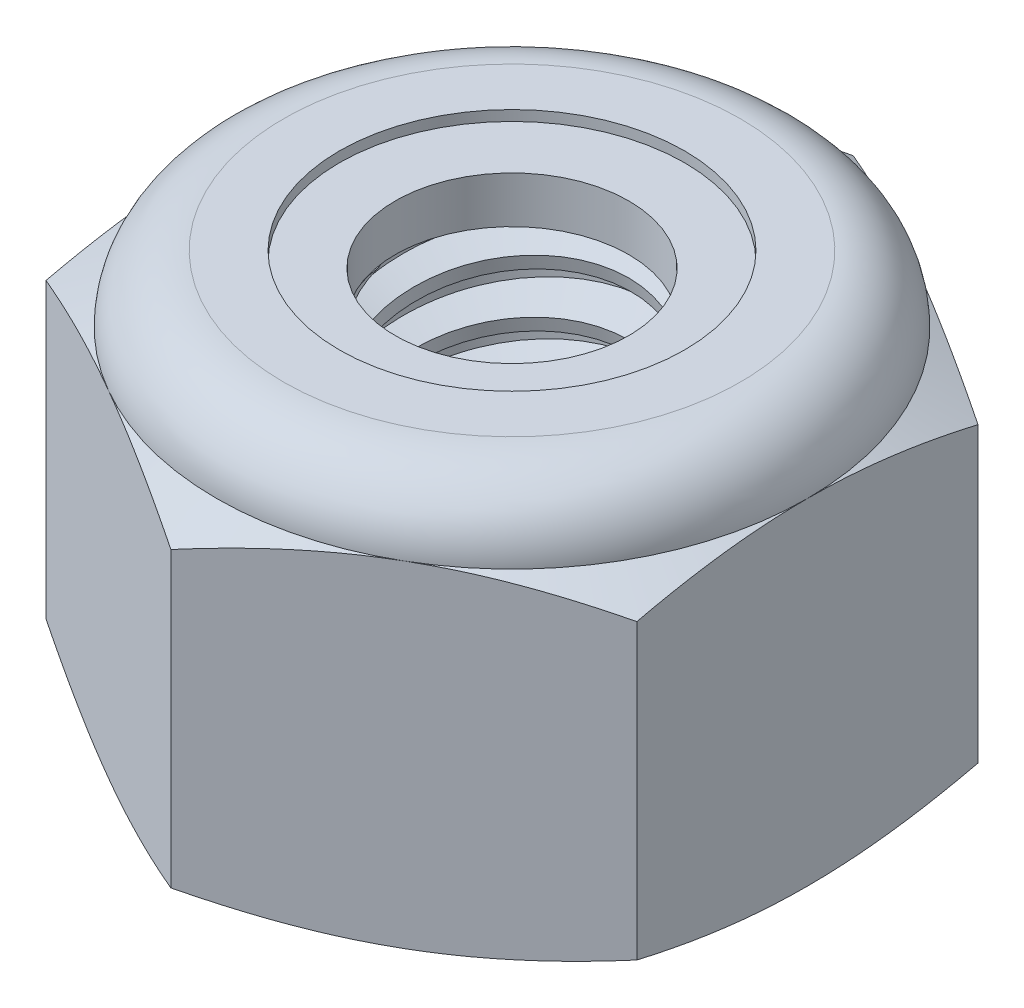
from build123d import *

# Parameters (mm, degrees)
EXTRUDE1_DEPTH      = 5.953125
SKETCH2_W           = 2.0828
SKETCH2_H           = 5.953125
LPATTERN1_COUNT     = 8
LPATTERN1_PITCH     = 0.79375
LPATTERN1_COL_COUNT = 2
LPATTERN1_COL_PITCH = 0.79375


with BuildPart() as part:
    # Sketch1 → Extrude1 (new body)
    with BuildSketch(Plane(origin=(0, 0, 0), x_dir=(1, 0, 0), z_dir=(0, 1, 0))):
        Polygon((0, 5.040989538), (-4.365625, 2.520494769), (-4.365625, -2.520494769), (0, -5.040989538), (4.365625, -2.520494769), (4.365625, 2.520494769), align=None)
    extrude(amount=EXTRUDE1_DEPTH)

    # Sketch4 → Cut-Revolve2 (revolve, cut)
    with BuildSketch(Plane(origin=(0, 0, 0), x_dir=(0, 0, -1), z_dir=(1, 0, 0)), mode=Mode.PRIVATE) as cut_revolve2_sk:
        Polygon((0, 5.953125), (2.0828, 5.953125), (1.725765218, 5.786636947), (1.725765218, 0.166488053), (2.0828, 0), (0, 0), align=None)
    revolve(cut_revolve2_sk.sketch.rotate(Axis((0, 5.953125, 0), (0, 1, 0)), 54.618153421), axis=Axis((0, 5.953125, 0), (0, 1, 0)), mode=Mode.SUBTRACT)


with BuildPart() as body_2:
    # Sketch2 → Revolve1 (revolve)
    with BuildSketch(Plane(origin=(0, 0, 0), x_dir=(0, 0, -1), z_dir=(1, 0, 0))):
        with Locations((1.0414, 2.9765625)):
            Rectangle(SKETCH2_W, SKETCH2_H)
    revolve(axis=Axis((0, -2.0828, 0), (0, 1, 0)))

    # Sketch3 → Cut-Revolve1 (revolve, cut)
    with BuildSketch(Plane(origin=(0, 0, 0), x_dir=(0, 0, -1), z_dir=(1, 0, 0)), mode=Mode.PRIVATE) as cut_revolve1_sk:
        Polygon((2.101371857, 5.855659896), (2.231374854, 5.173404168), (1.762908932, 5.33664843), (1.725765218, 5.531578638), align=None)
    cut_revolve1 = revolve(cut_revolve1_sk.sketch.rotate(Axis((0, 5.953125, 0.162231854), (0, -0.9823254572523518, -0.18718091792156122)), 180), axis=Axis((0, 5.953125, 0.162231854), (0, -0.9823254572523518, -0.18718091792156122)), mode=Mode.SUBTRACT)

    # LPattern1: Cut-Revolve1 ×8
    with Locations(*[(0, -i * LPATTERN1_PITCH, 0) for i in range(1, LPATTERN1_COUNT)]):
        add(cut_revolve1, mode=Mode.SUBTRACT)

    # LPattern1 col: Cut-Revolve1 ×2
    with Locations(*[(0, i * LPATTERN1_COL_PITCH, 0) for i in range(1, LPATTERN1_COL_COUNT)]):
        add(cut_revolve1, mode=Mode.SUBTRACT)


with BuildPart() as part_1:
    add(part.part)

    # Combine1: cut body 2
    add(body_2.part, mode=Mode.SUBTRACT)

    # Sketch5 → Cut-Revolve3 (revolve, cut)
    with BuildSketch(Plane(origin=(0, 0, 0), x_dir=(0, 0, -1), z_dir=(1, 0, 0)), mode=Mode.PRIVATE) as cut_revolve3_sk:
        with BuildLine():
            Line((0, 0), (4.365625, 0))
            Line((4.365625, 0), (5.040989538, 0.314927656))
            Line((5.040989538, 0.314927656), (5.040989538, 4.646009844))
            Line((5.040989538, 4.646009844), (4.365625, 4.9609375))
            ThreePointArc((4.365625, 4.9609375), (4.075020009, 5.662520009), (3.3734375, 5.953125))
            Line((3.3734375, 5.953125), (3.3734375, 7.223125))
            Line((3.3734375, 7.223125), (6.310989538, 7.223125))
            Line((6.310989538, 7.223125), (6.310989538, -1.27))
            Line((6.310989538, -1.27), (0, -1.27))
            Line((0, -1.27), (0, 0))
        make_face()
    revolve(cut_revolve3_sk.sketch.rotate(Axis((0, 0, 0), (0, 1, 0)), 54.618153421), axis=Axis((0, 0, 0), (0, 1, 0)), mode=Mode.SUBTRACT)

    # Sketch6 → Cut-Revolve4 (revolve, cut)
    with BuildSketch(Plane(origin=(0, 0, 0), x_dir=(0, 0, -1), z_dir=(1, 0, 0)), mode=Mode.PRIVATE) as cut_revolve4_sk:
        with BuildLine():
            Line((0, 4.9609375), (4.213225, 4.9609375))
            ThreePointArc((4.213225, 4.9609375), (3.967256936, 5.554756936), (3.3734375, 5.800725))
            Line((3.3734375, 5.800725), (2.549601359, 5.800725))
            Line((2.549601359, 5.800725), (2.549601359, 7.223125))
            Line((2.549601359, 7.223125), (0, 7.223125))
            Line((0, 7.223125), (0, 4.9609375))
        make_face()
    revolve(cut_revolve4_sk.sketch.rotate(Axis((0, 7.223125, 0), (0, 1, 0)), 54.618153421), axis=Axis((0, 7.223125, 0), (0, 1, 0)), mode=Mode.SUBTRACT)


with BuildPart() as body_2_2:
    # Sketch7 → Revolve2 (revolve)
    with BuildSketch(Plane(origin=(0, 0, 0), x_dir=(0, 0, -1), z_dir=(1, 0, 0))):
        with BuildLine():
            Line((1.725765218, 5.0371375), (4.133213408, 5.0371375))
            ThreePointArc((4.133213408, 5.0371375), (3.885726726, 5.527175629), (3.3734375, 5.724525))
            Line((3.3734375, 5.724525), (1.725765218, 5.724525))
            Line((1.725765218, 5.724525), (1.725765218, 5.0371375))
        make_face()
    revolve(axis=Axis((0, 5.0371375, 0), (0, 1, 0)))


solid = Compound([part_1.part, body_2_2.part])
